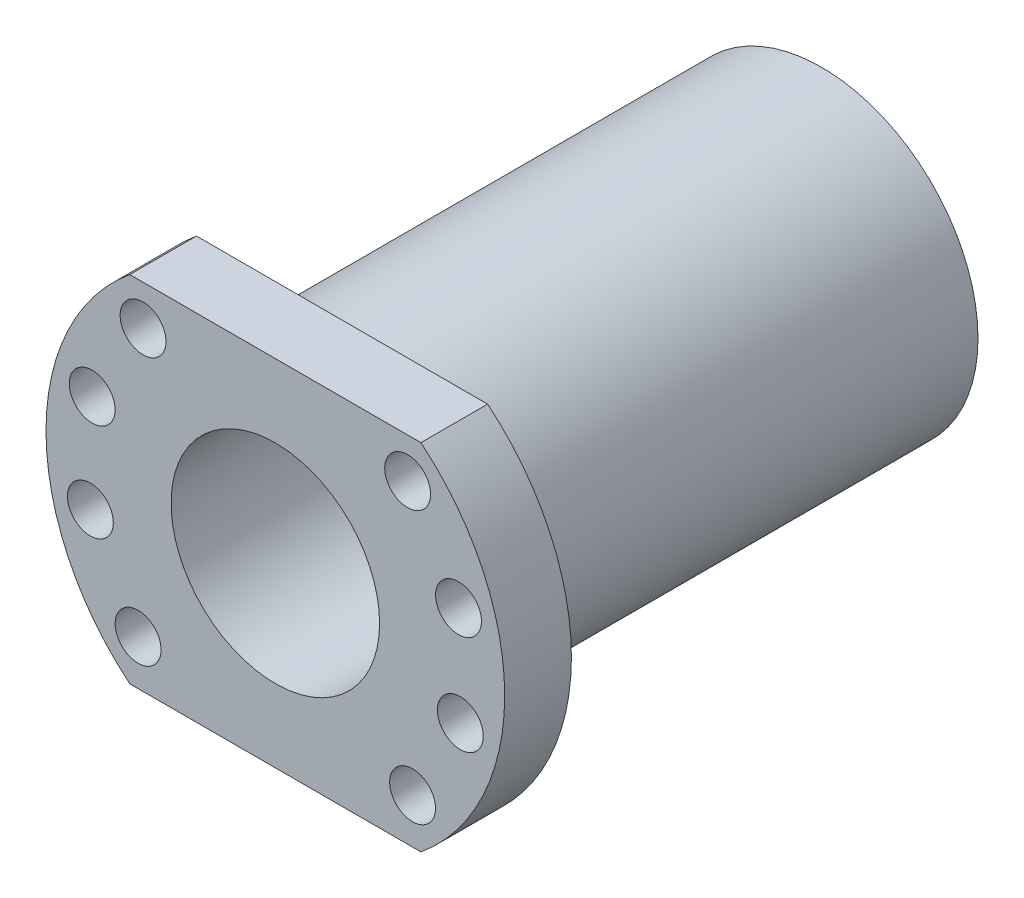
from build123d import *

# Parameters (mm, degrees)
SKETCH_1_R          = 25
EXTRUDE_1_DEPTH     = 16
SKETCH_2_R          = 5.5
CUT_EXTRUDE_1_DEPTH = 72.324960568
SKETCH_3_R          = 37.5
EXTRUDE_2_DEPTH     = 115
SKETCH_4_R          = 25
CUT_EXTRUDE_2_DEPTH = 135.373546504


with BuildPart() as part:
    # 草图1 → 凸台-拉伸1 (new body)
    with BuildSketch(Plane.XY):
        with BuildLine():
            Line((-34.910600109, 42.5), (34.910600109, 42.5))
            ThreePointArc((34.910600109, 42.5), (55, 0), (34.910600109, -42.5))
            Line((34.910600109, -42.5), (-34.910600109, -42.5))
            ThreePointArc((-34.910600109, -42.5), (-55, 0), (-34.910600109, 42.5))
        make_face()
        Circle(SKETCH_1_R, mode=Mode.SUBTRACT)
    extrude(amount=EXTRUDE_1_DEPTH)

    # 草图2 → 切除-拉伸1 (cut, through all)
    with BuildSketch(Plane.XY.offset(16)):
        with Locations((-31.723911196, 32.908104345)):
            Circle(SKETCH_2_R)
        with Locations((-43.927765176, 12.637298755)):
            Circle(SKETCH_2_R)
        with Locations((-44.361209952, -11.019660831)):
            Circle(SKETCH_2_R)
        with Locations((-32.908104345, -31.723911196)):
            Circle(SKETCH_2_R)
        with Locations(Location((32.908104345, -31.723911196, 0), (0, 0, 180))):
            Circle(SKETCH_2_R)
        with Locations(Location((44.361209952, -11.019660831, 0), (0, 0, 180))):
            Circle(SKETCH_2_R)
        with Locations(Location((43.927765176, 12.637298755, 0), (0, 0, 180))):
            Circle(SKETCH_2_R)
        with Locations(Location((31.723911196, 32.908104345, 0), (0, 0, 180))):
            Circle(SKETCH_2_R)
    extrude(amount=-CUT_EXTRUDE_1_DEPTH, mode=Mode.SUBTRACT)

    # 草图3 → 凸台-拉伸2 (add)
    with BuildSketch(Plane(origin=(0, 0, 0), x_dir=(-1, 0, 0), z_dir=(0, 0, -1))):
        with Locations(Location((0, 0, 0), (0, 0, 180))):
            Circle(SKETCH_3_R)
    extrude(amount=EXTRUDE_2_DEPTH)

    # 草图4 → 切除-拉伸2 (cut, through all)
    with BuildSketch(Plane.XY):
        Circle(SKETCH_4_R)
    extrude(amount=-CUT_EXTRUDE_2_DEPTH, mode=Mode.SUBTRACT)


solid = part.part
